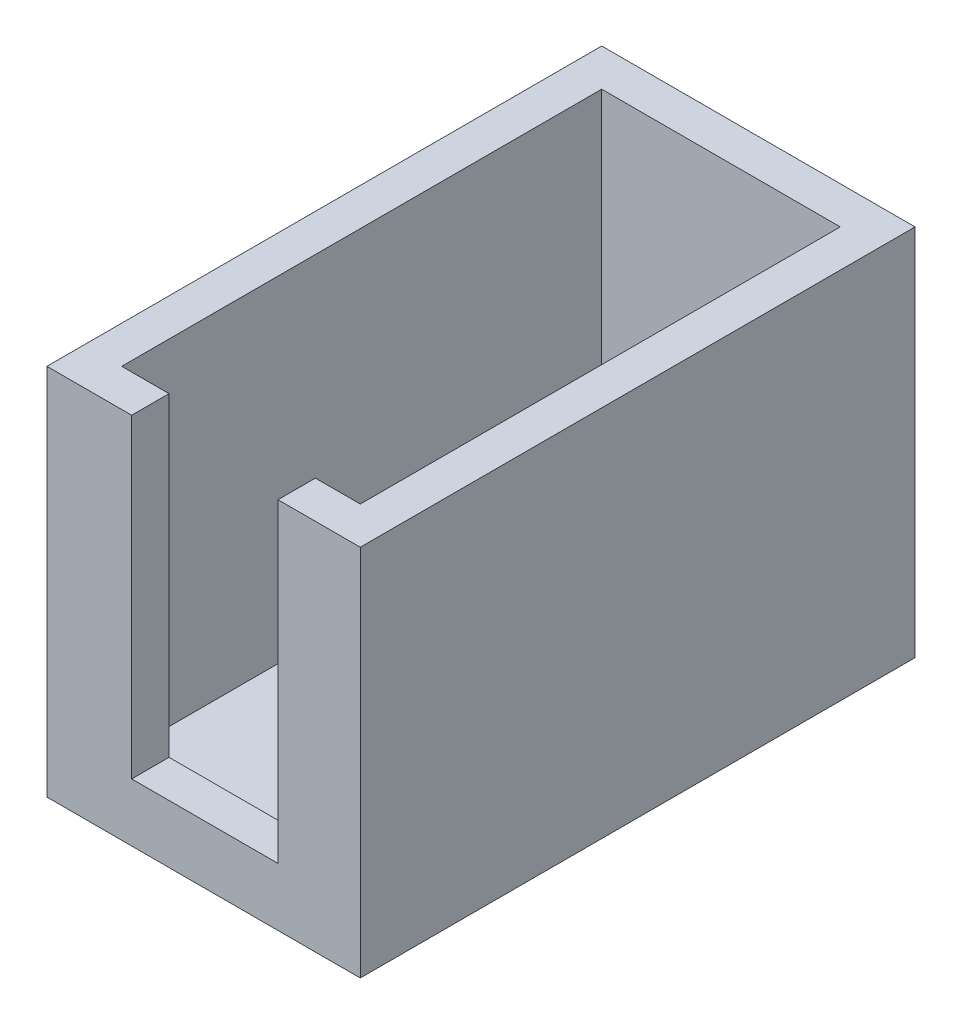
from build123d import *

# Parameters (mm, degrees)
SKETCH2_W           = 20.254
SKETCH2_H           = 40.754
BOSS_EXTRUDE1_DEPTH = 28.5
SHELL1_T            = 3.175
SKETCH3_W           = 12.42355449
SKETCH3_H           = 26.741974476
CUT_EXTRUDE1_DEPTH  = 3.175


with BuildPart() as part:
    # Sketch2 → Boss-Extrude1 (new body)
    with BuildSketch(Plane(origin=(0, 0, 0), x_dir=(1, 0, 0), z_dir=(0, 1, 0))):
        Rectangle(SKETCH2_W, SKETCH2_H)
    extrude(amount=BOSS_EXTRUDE1_DEPTH)

    # Shell1
    shell1_openings = [part.faces().sort_by_distance(p)[0] for p in [
        (0, 28.5, 0),
    ]]
    offset(amount=SHELL1_T, openings=shell1_openings, kind=Kind.INTERSECTION)

    # Sketch3 → Cut-Extrude1 (cut)
    with BuildSketch(Plane.XY.offset(23.552)):
        with Locations((0.103875874, 15.129012762)):
            Rectangle(SKETCH3_W, SKETCH3_H)
    extrude(amount=-CUT_EXTRUDE1_DEPTH, mode=Mode.SUBTRACT)


solid = part.part
